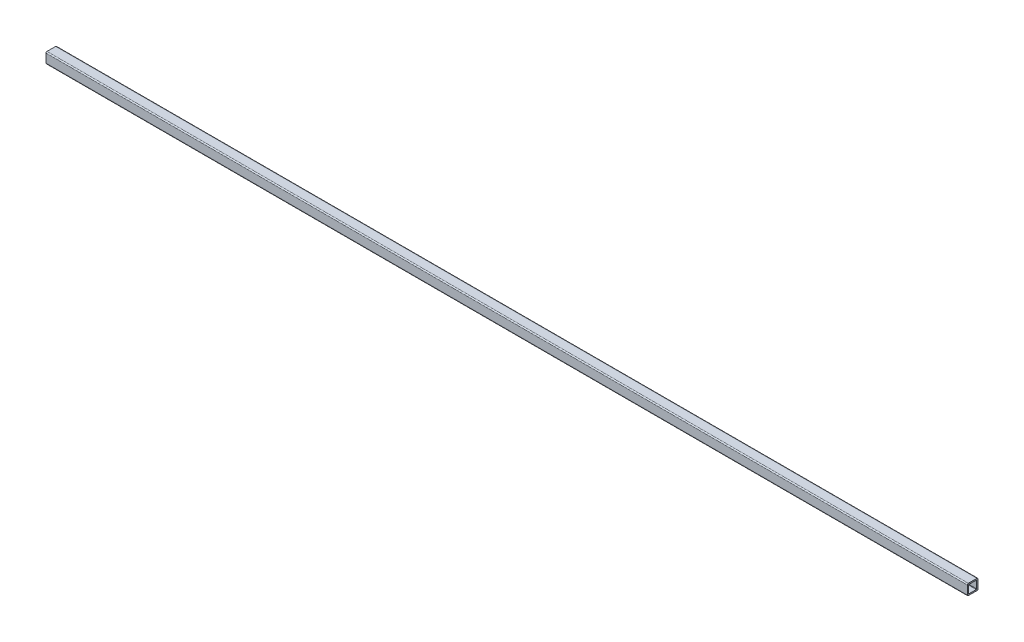
from build123d import *

# Parameters (mm, degrees)
SKETCH3_W           = 25.4
SKETCH3_H           = 25.4
SKETCH3_W_2         = 19.304
SKETCH3_H_2         = 19.304
BOSS_EXTRUDE1_DEPTH = 2185.66
FILLET1_R           = 2.5
FILLET2_R           = 1


with BuildPart() as part:
    # Sketch3 → Boss-Extrude1 (new body)
    with BuildSketch(Plane(origin=(0, 0, 0), x_dir=(0, 0, -1), z_dir=(1, 0, 0))):
        Rectangle(SKETCH3_W, SKETCH3_H)
        Rectangle(SKETCH3_W_2, SKETCH3_H_2, mode=Mode.SUBTRACT)
    extrude(amount=-BOSS_EXTRUDE1_DEPTH)

    # Fillet1
    fillet1_edges = [part.edges().sort_by_distance(p)[0] for p in [
        (-1092.83, -12.7, -12.7),
        (-1092.83, -12.7, 12.7),
        (-1092.83, 12.7, 12.7),
        (-1092.83, 12.7, -12.7),
    ]]
    fillet(fillet1_edges, radius=FILLET1_R)

    # Fillet2
    fillet2_edges = [part.edges().sort_by_distance(p)[0] for p in [
        (-1092.83, 9.652, -9.652),
        (-1092.83, -9.652, -9.652),
        (-1092.83, -9.652, 9.652),
        (-1092.83, 9.652, 9.652),
    ]]
    fillet(fillet2_edges, radius=FILLET2_R)


solid = part.part
